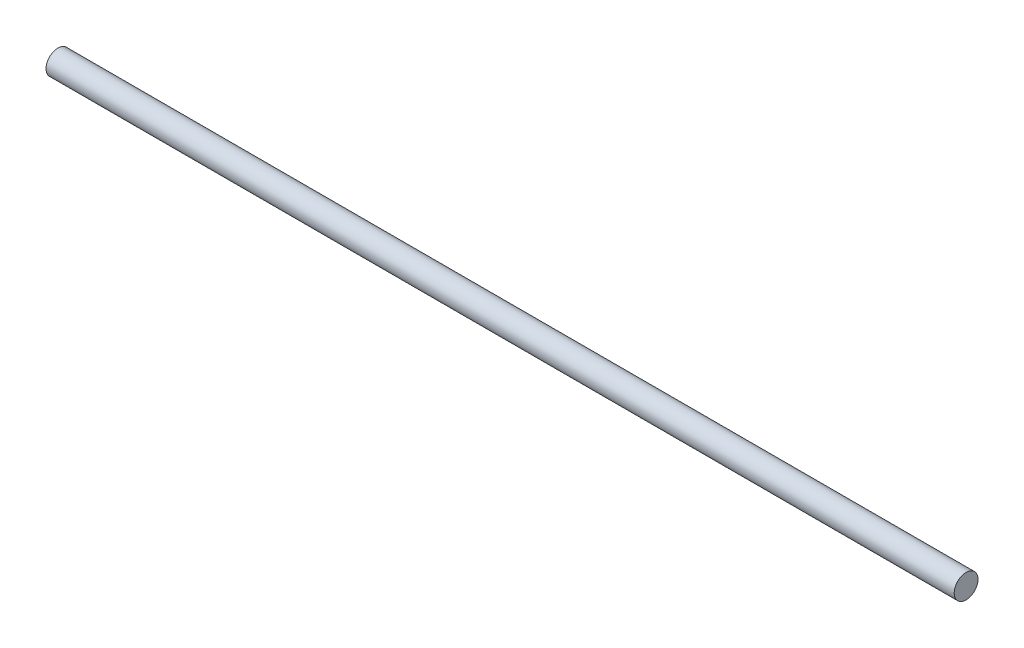
from build123d import *

# Parameters (mm, degrees)
SKETCH1_R           = 8
BOSS_EXTRUDE1_DEPTH = 304.8


with BuildPart() as part:
    # Sketch1 → Boss-Extrude1 (new, symmetric)
    with BuildSketch(Plane(origin=(0, 0, 0), x_dir=(0, 0, -1), z_dir=(1, 0, 0))):
        with Locations(Location((0, 0, 0), (0, 0, 180))):
            Circle(SKETCH1_R)
    extrude(amount=BOSS_EXTRUDE1_DEPTH, both=True)


solid = part.part
